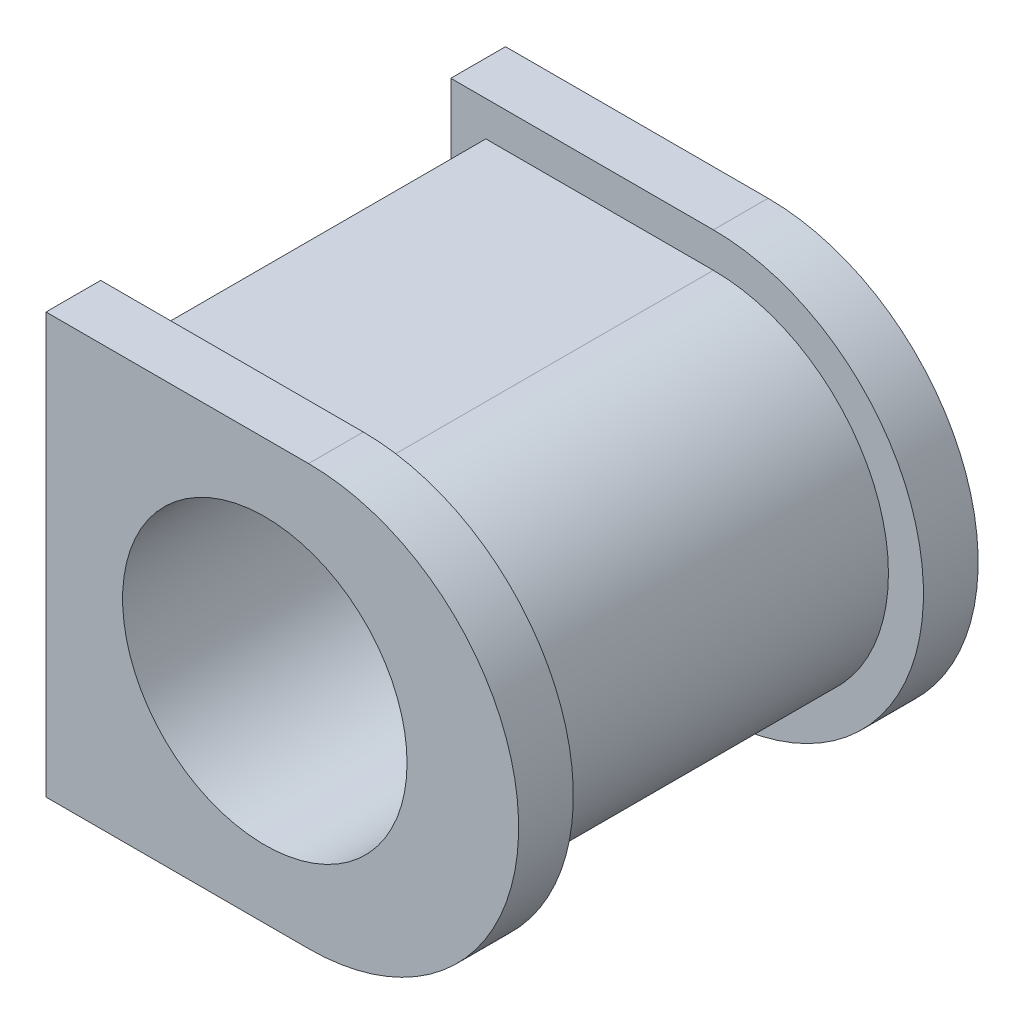
from build123d import *

# Parameters (mm, degrees)
SKETCH1_R           = 32.5
BOSS_EXTRUDE1_DEPTH = 40
SKETCH2_R           = 32.5
BOSS_EXTRUDE4_DEPTH = 12.5


with BuildPart() as part:
    # Sketch1 → Boss-Extrude1 (new, symmetric)
    with BuildSketch(Plane.XY):
        with BuildLine():
            Line((-26, -40), (26, -40))
            ThreePointArc((26, -40), (66, 0), (26, 40))
            Line((26, 40), (-26, 40))
            Line((-26, 40), (-26, -40))
        make_face()
        with Locations((16, 0)):
            Circle(SKETCH1_R, mode=Mode.SUBTRACT)
    extrude(amount=BOSS_EXTRUDE1_DEPTH, both=True)

    # Sketch2 → Boss-Extrude4 (add)
    with BuildSketch(Plane.XY.offset(40)):
        with BuildLine():
            Line((26, 48), (-34, 48))
            Line((-34, 48), (-34, -48))
            Line((-34, -48), (26, -48))
            ThreePointArc((26, -48), (74, 0), (26, 48))
        make_face()
        with Locations((16, 0)):
            Circle(SKETCH2_R, mode=Mode.SUBTRACT)
    boss_extrude4 = extrude(amount=BOSS_EXTRUDE4_DEPTH)

    # Mirror1: Boss-Extrude4 across plane
    add(boss_extrude4.mirror(Plane.XY))


solid = part.part
